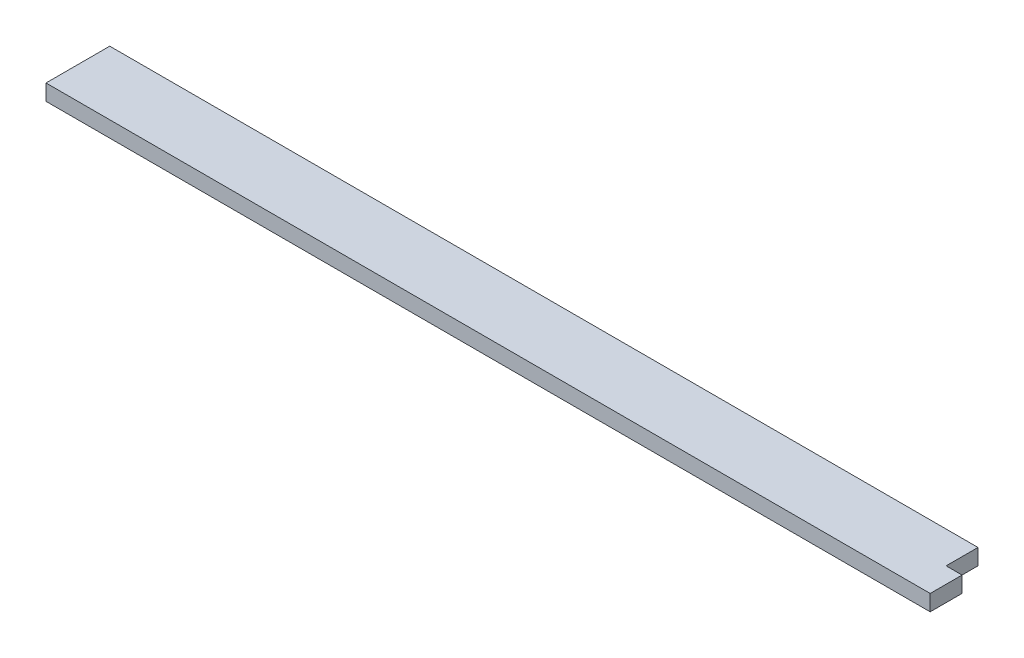
from build123d import *

# Parameters (mm, degrees)
BOSS_EXTRUDE1_DEPTH = 3.175


with BuildPart() as part:
    # Sketch1 → Boss-Extrude1 (new body)
    with BuildSketch(Plane(origin=(0, 0, 0), x_dir=(1, 0, 0), z_dir=(0, 1, 0))):
        Polygon((84.8995, 6.35), (84.8995, 0), (88.0745, 0), (88.0745, -6.35), (-88.0745, -6.35), (-88.0745, 6.35), align=None)
    extrude(amount=BOSS_EXTRUDE1_DEPTH)


solid = part.part
